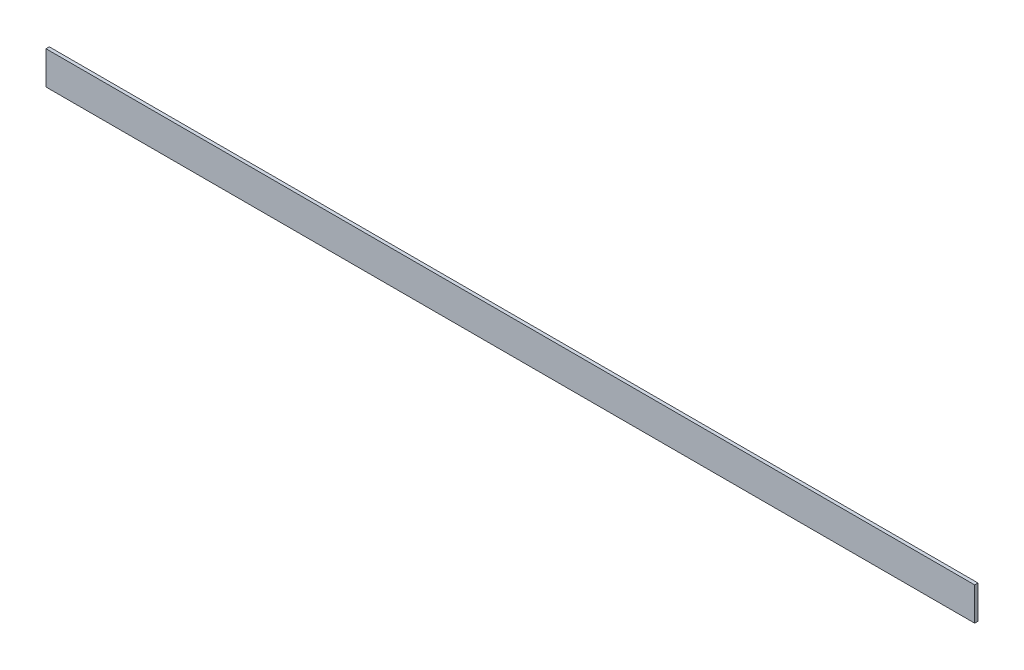
from build123d import *

# Parameters (mm, degrees)
SKETCH2_W           = 560
SKETCH2_H           = 20
BOSS_EXTRUDE1_DEPTH = 2


with BuildPart() as part:
    # Sketch2 → Boss-Extrude1 (new body)
    with BuildSketch(Plane.XY):
        Rectangle(SKETCH2_W, SKETCH2_H)
    extrude(amount=BOSS_EXTRUDE1_DEPTH)


solid = part.part
